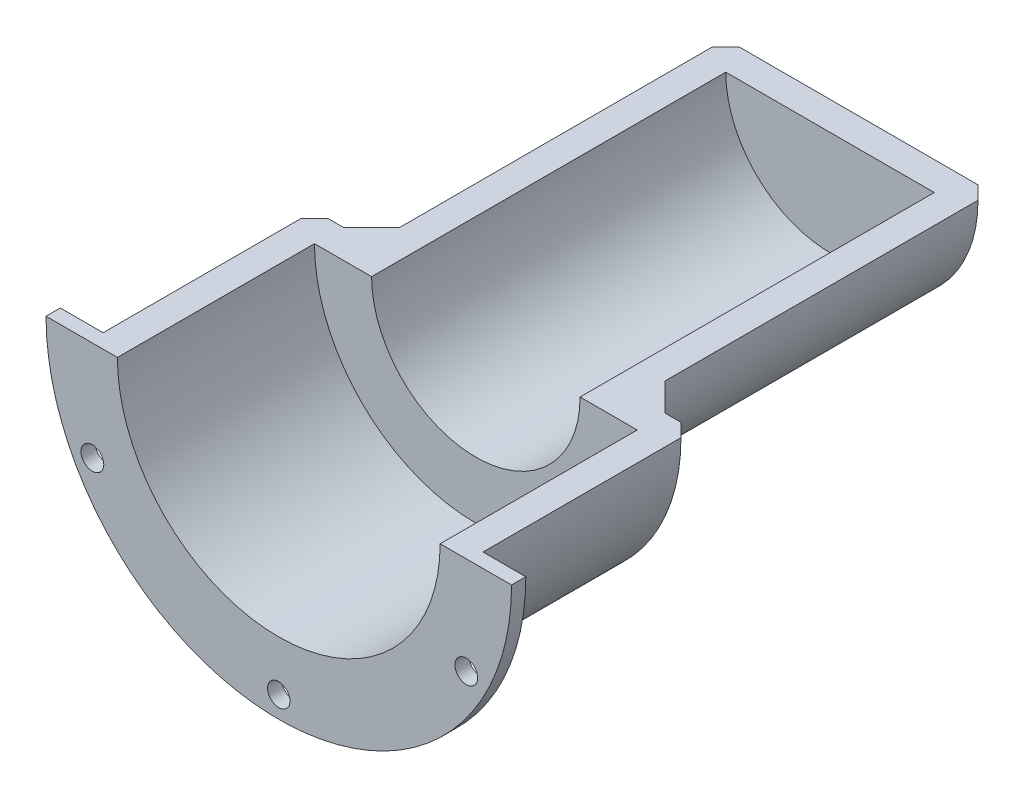
from build123d import *

# Parameters (mm, degrees)
BOSS_EXTRUDE1_DEPTH = 62.992
CUT_EXTRUDE1_DEPTH  = 57.912
BOSS_EXTRUDE2_DEPTH = 40.132
CUT_EXTRUDE2_DEPTH  = 40.132
CUT_EXTRUDE3_DEPTH  = 35.052
BOSS_EXTRUDE3_DEPTH = 2.54
CUT_EXTRUDE4_DEPTH  = 2.54
CHAMFER1_SIZE       = 4.92
CHAMFER3_SIZE       = 2.38
CHAMFER4_SIZE       = 2.38
SKETCH12_R          = 2
CUT_EXTRUDE6_DEPTH  = 2.54
SKETCH16_R          = 2.032
CUT_EXTRUDE7_DEPTH  = 2.54


with BuildPart() as part:
    # Sketch2 → Boss-Extrude1 (new body)
    with BuildSketch(Plane.XY):
        with BuildLine():
            Line((-23.622, 0), (23.622, 0))
            ThreePointArc((23.622, 0), (0, -23.622), (-23.622, 0))
        make_face()
    extrude(amount=-BOSS_EXTRUDE1_DEPTH)

    # Sketch3 → Cut-Extrude1 (cut)
    with BuildSketch(Plane.XY):
        with BuildLine():
            Line((-18.542, 0), (18.542, 0))
            ThreePointArc((18.542, 0), (0, -18.542), (-18.542, 0))
        make_face()
    extrude(amount=-CUT_EXTRUDE1_DEPTH, mode=Mode.SUBTRACT)

    # Sketch5 → Boss-Extrude2 (add)
    with BuildSketch(Plane.XY):
        with BuildLine():
            Line((-33.782, 0), (33.782, 0))
            ThreePointArc((33.782, 0), (0, -33.782), (-33.782, 0))
        make_face()
    extrude(amount=BOSS_EXTRUDE2_DEPTH)

    # Sketch6 → Cut-Extrude2 (cut)
    with BuildSketch(Plane.XY.offset(40.132)):
        with BuildLine():
            Line((-18.542, 0), (18.542, 0))
            ThreePointArc((18.542, 0), (0, -18.542), (-18.542, 0))
        make_face()
    extrude(amount=-CUT_EXTRUDE2_DEPTH, mode=Mode.SUBTRACT)

    # Sketch7 → Cut-Extrude3 (cut)
    with BuildSketch(Plane.XY.offset(40.132)):
        with BuildLine():
            Line((-28.702, 0), (28.702, 0))
            ThreePointArc((28.702, 0), (0, -28.702), (-28.702, 0))
        make_face()
    extrude(amount=-CUT_EXTRUDE3_DEPTH, mode=Mode.SUBTRACT)

    # Sketch9 → Boss-Extrude3 (add)
    with BuildSketch(Plane.XY.offset(40.132)):
        with BuildLine():
            Line((-41.402, 0), (41.402, 0))
            ThreePointArc((41.402, 0), (0, -41.402), (-41.402, 0))
        make_face()
    extrude(amount=-BOSS_EXTRUDE3_DEPTH)

    # Sketch10 → Cut-Extrude4 (cut)
    with BuildSketch(Plane.XY.offset(40.132)):
        with BuildLine():
            Line((-28.702, 0), (28.702, 0))
            ThreePointArc((28.702, 0), (0, -28.702), (-28.702, 0))
        make_face()
    extrude(amount=-CUT_EXTRUDE4_DEPTH, mode=Mode.SUBTRACT)

    # Chamfer1
    chamfer1_edges = [part.edges().sort_by_distance(p)[0] for p in [
        (0, -23.622, 0),
    ]]
    chamfer(chamfer1_edges, length=CHAMFER1_SIZE)

    # Chamfer3
    chamfer3_edges = [part.edges().sort_by_distance(p)[0] for p in [
        (0, -23.622, -62.992),
    ]]
    chamfer(chamfer3_edges, length=CHAMFER3_SIZE)

    # Chamfer4
    chamfer4_edges = [part.edges().sort_by_distance(p)[0] for p in [
        (0, -33.782, 0),
    ]]
    chamfer(chamfer4_edges, length=CHAMFER4_SIZE)

    # Sketch12 → Cut-Extrude6 (cut)
    with BuildSketch(Plane(origin=(0, 0, 37.592), x_dir=(-1, 0, 0), z_dir=(0, 0, -1))):
        with Locations((0, -37.592)):
            Circle(SKETCH12_R)
    extrude(amount=-CUT_EXTRUDE6_DEPTH, mode=Mode.SUBTRACT)

    # Sketch16 → Cut-Extrude7 (cut)
    with BuildSketch(Plane.XY.offset(40.132)):
        with Locations((-33.156425447, -17.714680792)):
            Circle(SKETCH16_R)
        with Locations((33.359405316, -17.329412596)):
            Circle(SKETCH16_R)
    extrude(amount=-CUT_EXTRUDE7_DEPTH, mode=Mode.SUBTRACT)


solid = part.part
